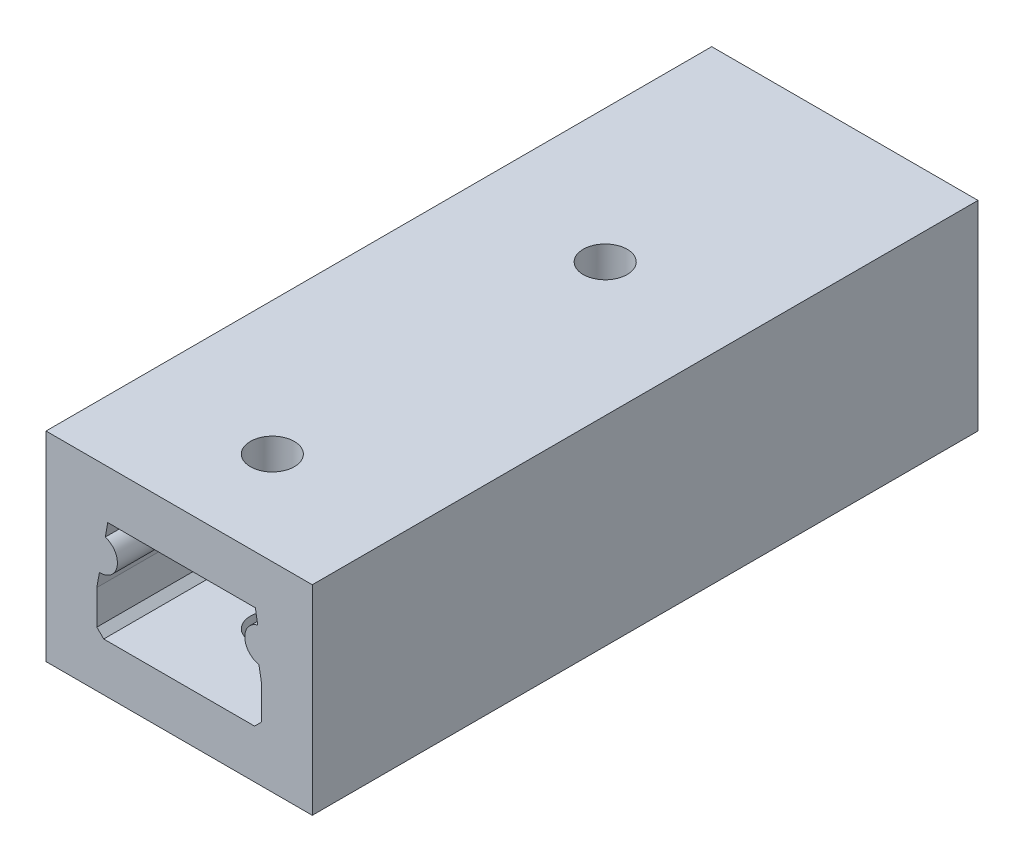
from build123d import *

# Parameters (mm, degrees)
SKETCH2_W           = 20
SKETCH2_H           = 15
BOSS_EXTRUDE1_DEPTH = 50
SKETCH3_R           = 1.65
CUT_EXTRUDE1_DEPTH  = 54.150729064


with BuildPart() as part:
    # Sketch2 → Boss-Extrude1 (new body)
    with BuildSketch(Plane.XY):
        with Locations((0, 3.75)):
            Rectangle(SKETCH2_W, SKETCH2_H)
        with BuildLine():
            Line((6.18, 0.4025), (6.18, 2.9775))
            Line((6.18, 2.9775), (5.988999354, 4.060718492))
            ThreePointArc((5.988999354, 4.060718492), (4.929202717, 5.285218638), (5.905225776, 6.577483513))
            Line((5.905225776, 6.577483513), (5.722724444, 7.6125))
            Line((5.722724444, 7.6125), (-5.362724444, 7.6125))
            Line((-5.362724444, 7.6125), (-5.545225776, 6.577483513))
            ThreePointArc((-5.545225776, 6.577483513), (-4.654560018, 5.122927971), (-5.988999354, 4.060718492))
            Line((-5.988999354, 4.060718492), (-6.18, 2.9775))
            Line((-6.18, 2.9775), (-6.18, 0.4025))
            Line((-6.18, 0.4025), (-5.665, -0.1125))
            Line((-5.665, -0.1125), (5.665, -0.1125))
            Line((5.665, -0.1125), (6.18, 0.4025))
        make_face(mode=Mode.SUBTRACT)
    extrude(amount=BOSS_EXTRUDE1_DEPTH)

    # Sketch3 → Cut-Extrude1 (cut, through all)
    with BuildSketch(Plane(origin=(0, 11.25, 0), x_dir=(1, 0, 0), z_dir=(0, 1, 0))):
        with Locations(Location((0, -18, 0), (0, 0, 270))):
            Circle(SKETCH3_R)
        with Locations(Location((0, -43, 0), (0, 0, 270))):
            Circle(SKETCH3_R)
    extrude(amount=-CUT_EXTRUDE1_DEPTH, mode=Mode.SUBTRACT)


solid = part.part
